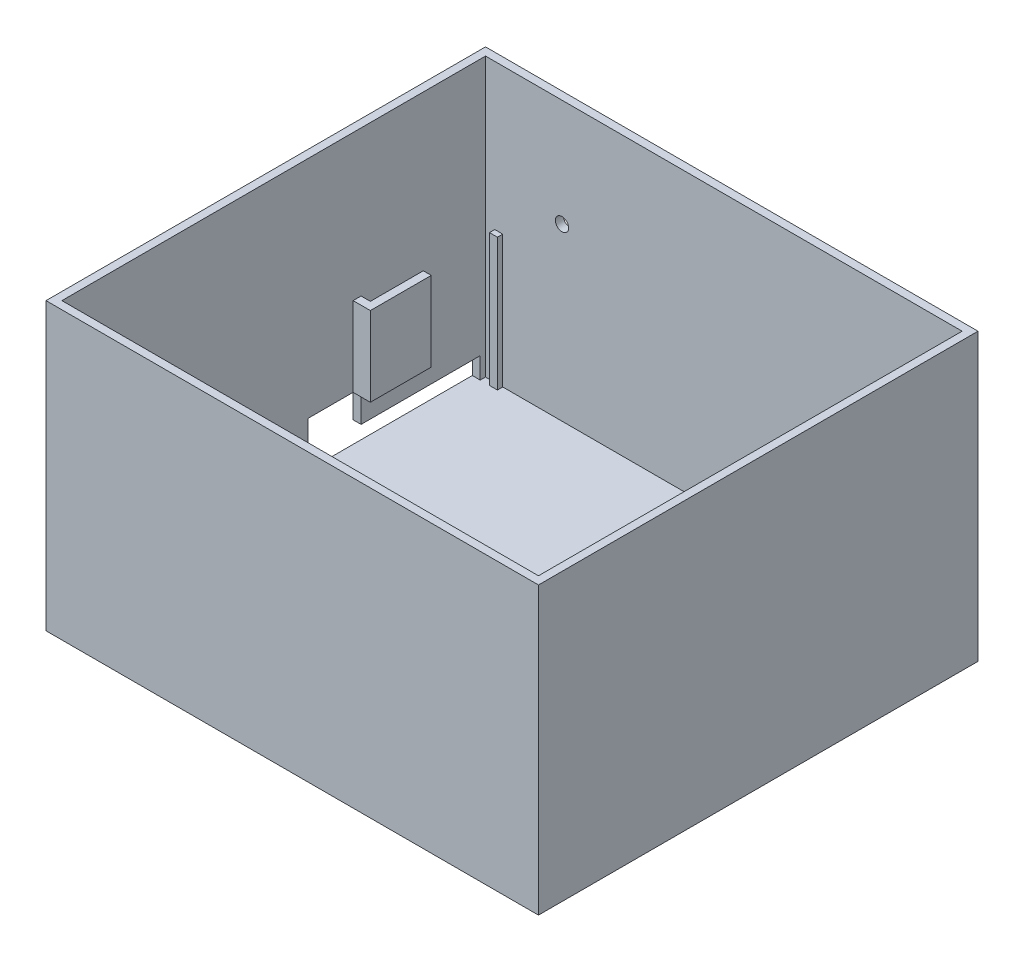
from build123d import *

# Parameters (mm, degrees)
SKETCH1_W            = 186
SKETCH1_H            = 166
BOSS_EXTRUDE6_DEPTH  = 3
SKETCH9_W            = 183
SKETCH9_H            = 3
BOSS_EXTRUDE7_DEPTH  = 105
SKETCH8_W            = 3
SKETCH8_H            = 163
BOSS_EXTRUDE8_DEPTH  = 105
SKETCH7_W            = 186
SKETCH7_H            = 3
BOSS_EXTRUDE9_DEPTH  = 105
SKETCH11_W           = 3
SKETCH11_H           = 160
BOSS_EXTRUDE10_DEPTH = 105
SKETCH12_W           = 180
SKETCH12_H           = 3
BOSS_EXTRUDE11_DEPTH = 20
SKETCH13_W           = 45
SKETCH13_H           = 8
CUT_EXTRUDE5_DEPTH   = 3
SKETCH20_W           = 3
SKETCH20_H           = 2
BOSS_EXTRUDE12_DEPTH = 50
SKETCH18_W           = 20
SKETCH18_H           = 20
CUT_EXTRUDE6_DEPTH   = 3
SKETCH22_W           = 3
SKETCH22_H           = 30
BOSS_EXTRUDE13_DEPTH = 6.5
SKETCH23_W           = 3
SKETCH23_H           = 30
BOSS_EXTRUDE15_DEPTH = 20
SKETCH24_R           = 2.5
CUT_EXTRUDE8_DEPTH   = 10


with BuildPart() as part:
    # Sketch1 → Boss-Extrude6 (new body)
    with BuildSketch(Plane(origin=(0, 0, 0), x_dir=(1, 0, 0), z_dir=(0, 1, 0))):
        with Locations((3.75, -30.125)):
            Rectangle(SKETCH1_W, SKETCH1_H)
    extrude(amount=BOSS_EXTRUDE6_DEPTH)

    # Sketch9 → Boss-Extrude7 (add)
    with BuildSketch(Plane(origin=(0, 3, 0), x_dir=(1, 0, 0), z_dir=(0, 1, 0))):
        with Locations((2.25, -111.625)):
            Rectangle(SKETCH9_W, SKETCH9_H)
    extrude(amount=BOSS_EXTRUDE7_DEPTH)

    # Sketch8 → Boss-Extrude8 (add)
    with BuildSketch(Plane(origin=(0, 3, 0), x_dir=(1, 0, 0), z_dir=(0, 1, 0))):
        with Locations((95.25, -31.625)):
            Rectangle(SKETCH8_W, SKETCH8_H)
    extrude(amount=BOSS_EXTRUDE8_DEPTH)

    # Sketch7 → Boss-Extrude9 (add)
    with BuildSketch(Plane(origin=(0, 3, 0), x_dir=(1, 0, 0), z_dir=(0, 1, 0))):
        with Locations((3.75, 51.375)):
            Rectangle(SKETCH7_W, SKETCH7_H)
    extrude(amount=BOSS_EXTRUDE9_DEPTH)

    # Sketch11 → Boss-Extrude10 (add)
    with BuildSketch(Plane(origin=(0, 3, 0), x_dir=(1, 0, 0), z_dir=(0, 1, 0))):
        with Locations((-87.75, -30.125)):
            Rectangle(SKETCH11_W, SKETCH11_H)
    extrude(amount=BOSS_EXTRUDE10_DEPTH)

    # Sketch12 → Boss-Extrude11 (add)
    with BuildSketch(Plane(origin=(0, 3, 0), x_dir=(1, 0, 0), z_dir=(0, 1, 0))):
        with Locations((3.75, -52.625)):
            Rectangle(SKETCH12_W, SKETCH12_H)
    extrude(amount=BOSS_EXTRUDE11_DEPTH)

    # Sketch13 → Cut-Extrude5 (cut)
    with BuildSketch(Plane(origin=(-86.25, 0, 0), x_dir=(0, 0, -1), z_dir=(1, 0, 0))):
        with Locations((25.375, 7)):
            Rectangle(SKETCH13_W, SKETCH13_H)
    extrude(amount=-CUT_EXTRUDE5_DEPTH, mode=Mode.SUBTRACT)

    # Sketch20 → Boss-Extrude12 (add)
    with BuildSketch(Plane(origin=(0, 3, 0), x_dir=(1, 0, 0), z_dir=(0, 1, 0))):
        with Locations((-81.25, 48.875)):
            Rectangle(SKETCH20_W, SKETCH20_H)
    extrude(amount=BOSS_EXTRUDE12_DEPTH)

    # Sketch18 → Cut-Extrude6 (cut)
    with BuildSketch(Plane.ZY.offset(89.25)):
        with Locations((7.125, 13)):
            Rectangle(SKETCH18_W, SKETCH18_H)
    extrude(amount=-CUT_EXTRUDE6_DEPTH, mode=Mode.SUBTRACT)

    # Sketch22 → Boss-Extrude13 (add)
    with BuildSketch(Plane(origin=(-86.25, 0, 0), x_dir=(0, 0, -1), z_dir=(1, 0, 0))):
        with Locations((1.375, 38)):
            Rectangle(SKETCH22_W, SKETCH22_H)
    extrude(amount=BOSS_EXTRUDE13_DEPTH)

    # Sketch23 → Boss-Extrude15 (add)
    with BuildSketch(Plane(origin=(0, 0, -2.875), x_dir=(-1, 0, 0), z_dir=(0, 0, -1))):
        with Locations((81.25, 38)):
            Rectangle(SKETCH23_W, SKETCH23_H)
    extrude(amount=BOSS_EXTRUDE15_DEPTH)

    # Sketch24 → Cut-Extrude8 (cut)
    with BuildSketch(Plane.XY.offset(-49.875)):
        with Locations((-57.365874662, 67.44295955)):
            Circle(SKETCH24_R)
    extrude(amount=-CUT_EXTRUDE8_DEPTH, mode=Mode.SUBTRACT)


solid = part.part
